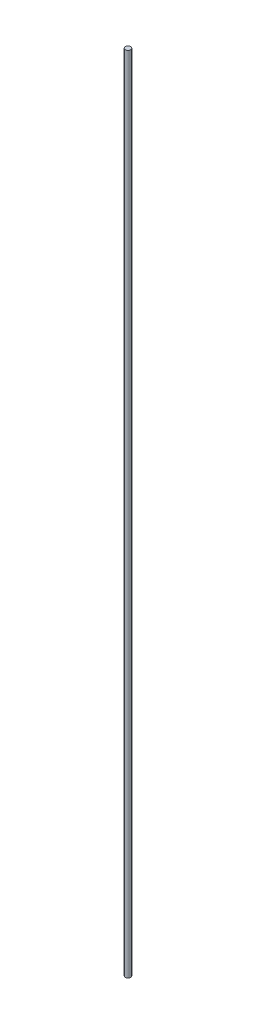
from build123d import *

# Parameters (mm, degrees)
SWEEP1_PROFILE_R = 6.35


with BuildPart() as part:
    # Sweep1: sweep along a path in Sketch1
    with BuildLine(Plane.XY) as sweep1_path:
        Line((0, 0), (0, 1885.696))
    # Sweep1 profile (on start of the path) → Sweep1 (sweep)
    with BuildSketch(Plane.ZX):
        Circle(SWEEP1_PROFILE_R)
    sweep(path=sweep1_path.line)


solid = part.part
